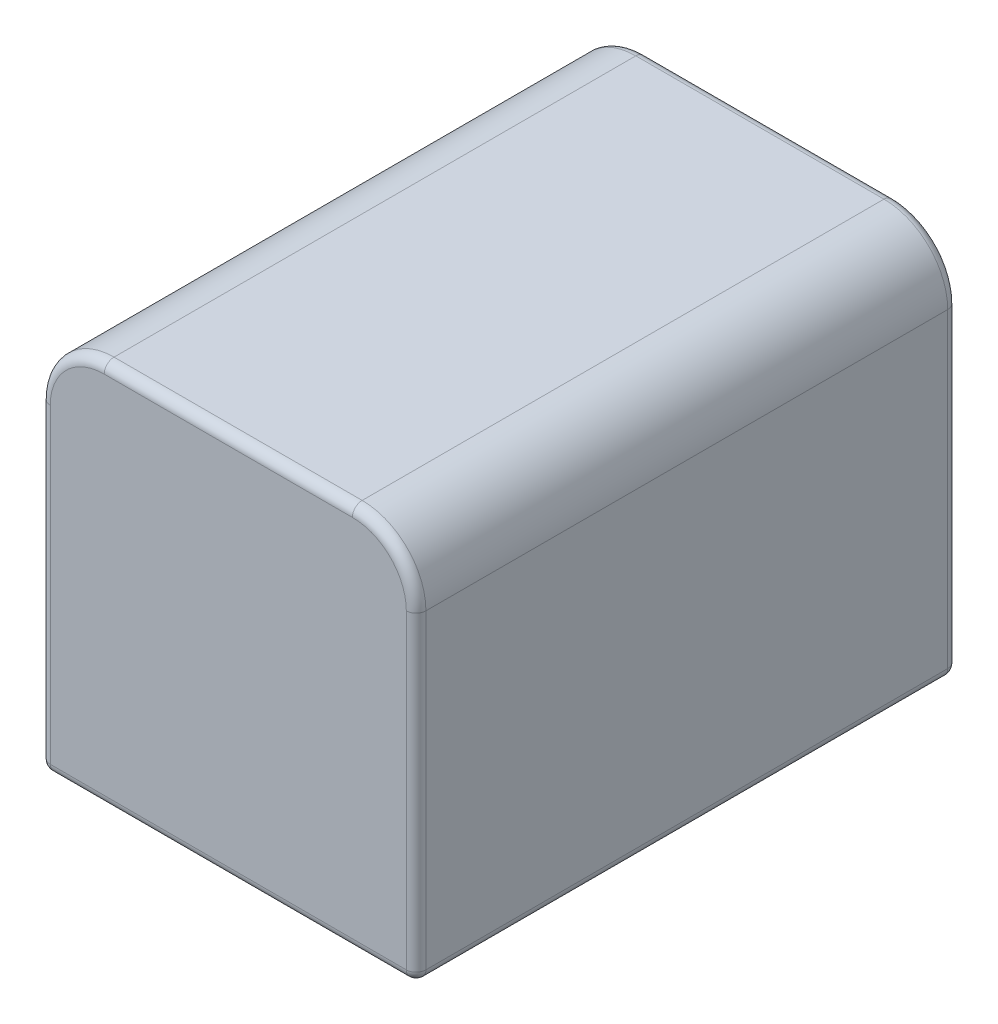
from build123d import *

# Parameters (mm, degrees)
EXTRUDE1_DEPTH = 55.2
FILLET1_R      = 1


with BuildPart() as part:
    # Sketch1 → Extrude1 (new body)
    with BuildSketch(Plane.XY):
        with BuildLine():
            Line((-19.15, 0), (19.15, 0))
            Line((19.15, 0), (19.15, 32.7))
            ThreePointArc((19.15, 32.7), (17.246194078, 37.296194078), (12.65, 39.2))
            Line((12.65, 39.2), (-12.65, 39.2))
            ThreePointArc((-12.65, 39.2), (-17.246194078, 37.296194078), (-19.15, 32.7))
            Line((-19.15, 32.7), (-19.15, 0))
        make_face()
    extrude(amount=EXTRUDE1_DEPTH)

    # Fillet1
    fillet1_edges = [part.edges().sort_by_distance(p)[0] for p in [
        (19.15, 16.35, 55.2),
        (19.15, 0, 27.6),
        (-19.15, 0, 27.6),
        (17.246194078, 37.296194078, 55.2),
        (0, 39.2, 55.2),
        (-17.246194078, 37.296194078, 55.2),
        (-19.15, 16.35, 55.2),
        (-17.246194078, 37.296194078, 0),
        (0, 39.2, 0),
        (17.246194078, 37.296194078, 0),
        (19.15, 16.35, 0),
        (0, 0, 55.2),
        (0, 0, 0),
        (-19.15, 16.35, 0),
    ]]
    fillet(fillet1_edges, radius=FILLET1_R)


solid = part.part
